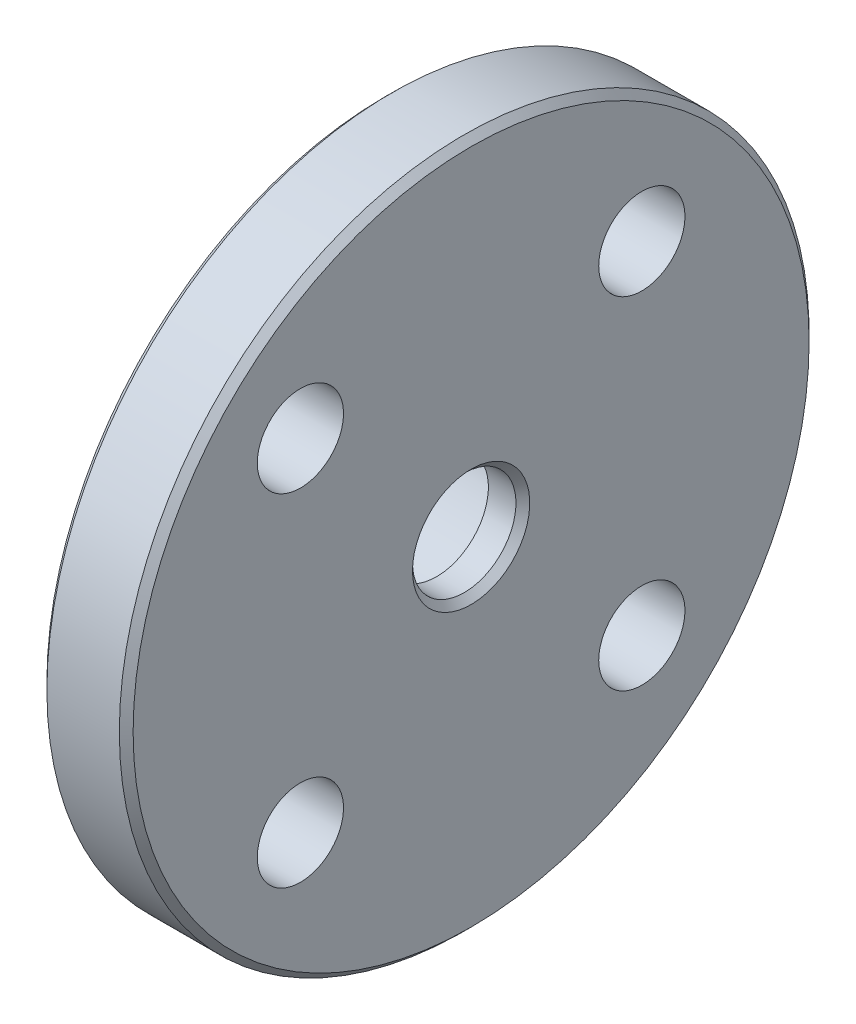
from build123d import *

# Parameters (mm, degrees)
SKETCH_3_R          = 1.25
CUT_EXTRUDE_1_DEPTH = 15.361406616
CHAMFER_1_SIZE      = 0.2


with BuildPart() as part:
    # 草图2 → 旋转1 (revolve)
    with BuildSketch(Plane.XY, mode=Mode.PRIVATE) as revolve_1_sk:
        Polygon((0, 3), (0, 4.5), (2, 4.5), (2, 10), (4.5, 10), (4.5, 1.5), (3.5, 1.5), (3.5, 3), align=None)
    revolve(revolve_1_sk.sketch.rotate(Axis((0, 0, 0), (1, 0, 0)), 90), axis=Axis((0, 0, 0), (1, 0, 0)))

    # 草图3 → 切除-拉伸1 (cut, through all)
    with BuildSketch(Plane.ZY.offset(-2)):
        with Locations((4.949747468, 4.949747468)):
            Circle(SKETCH_3_R)
        with Locations((4.949747468, -4.949747468)):
            Circle(SKETCH_3_R)
        with Locations((-4.949747468, -4.949747468)):
            Circle(SKETCH_3_R)
        with Locations((-4.949747468, 4.949747468)):
            Circle(SKETCH_3_R)
    extrude(amount=-CUT_EXTRUDE_1_DEPTH, mode=Mode.SUBTRACT)

    # 倒角1
    chamfer_1_edges = [part.edges().sort_by_distance(p)[0] for p in [
        (4.5, 0, -1.5),
        (4.5, 0, -10),
        (2, 0, -10),
        (0, 0, -4.5),
    ]]
    chamfer(chamfer_1_edges, length=CHAMFER_1_SIZE)


solid = part.part
